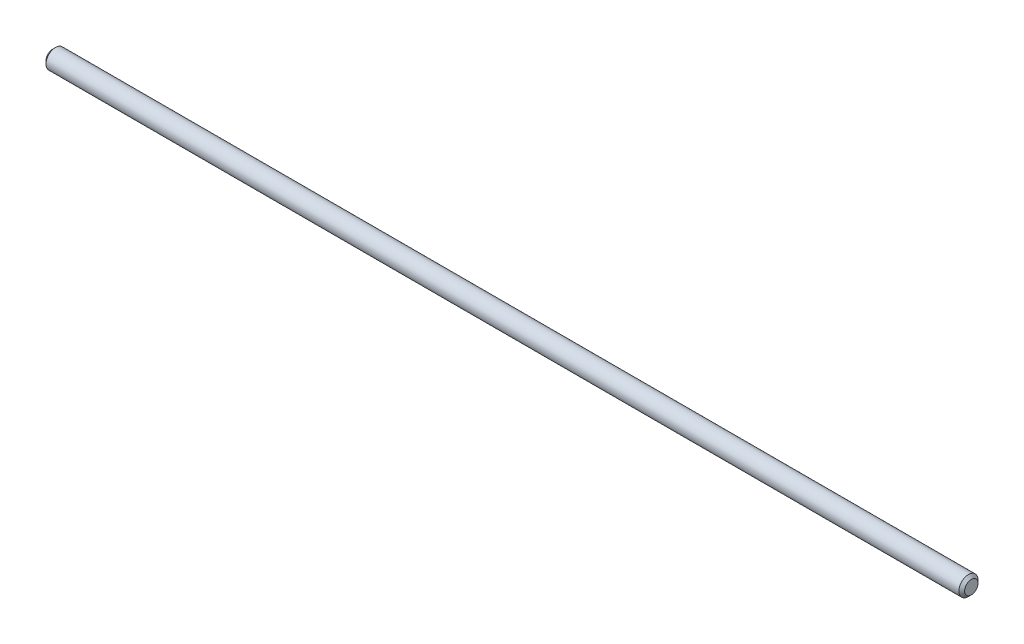
from build123d import *

# Parameters (mm, degrees)
BOSS_EXTRUDE1_DEPTH      = 152.4
BOSS_EXTRUDE1_DEPTH_BACK = 152.4
SKETCH2_R                = 3.175
CHAMFER1_SIZE            = 0.9525


with BuildPart() as part:
    # Sketch2 → Boss-Extrude1 (new, two sides: drawn at the far end of the back side and taken through both)
    with BuildSketch(Plane(origin=(0, 0, 0), x_dir=(0, 0, -1), z_dir=(1, 0, 0)).offset(-BOSS_EXTRUDE1_DEPTH_BACK)):
        Circle(SKETCH2_R)
    extrude(amount=BOSS_EXTRUDE1_DEPTH + BOSS_EXTRUDE1_DEPTH_BACK)

    # Chamfer1
    chamfer1_edges = [part.edges().sort_by_distance(p)[0] for p in [
        (-152.4, 0, 3.175),
        (152.4, 0, 3.175),
    ]]
    chamfer(chamfer1_edges, length=CHAMFER1_SIZE)


solid = part.part
